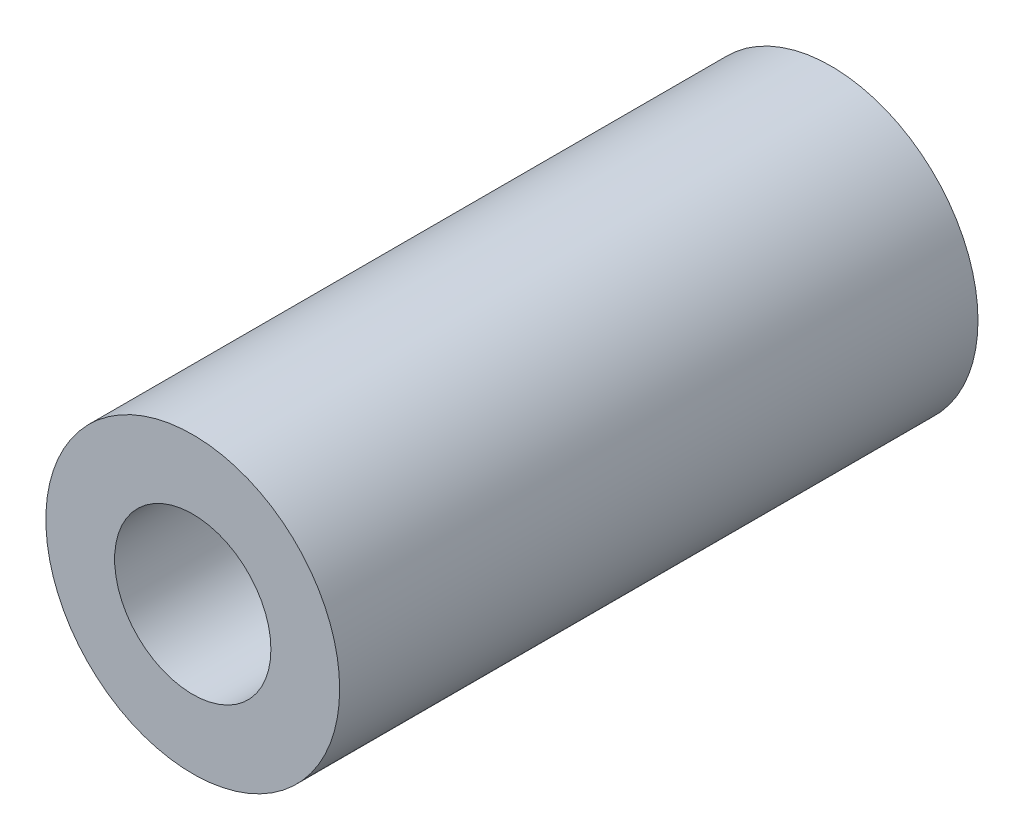
from build123d import *


with BuildPart() as part:
    # Sketch1 → Revolve1 (revolve)
    with BuildSketch(Plane(origin=(0, 0, 0), x_dir=(0, 0, -1), z_dir=(1, 0, 0)), mode=Mode.PRIVATE) as revolve1_sk:
        Polygon((0, 3.3782), (0, 6.35), (27.592250124, 6.35), (27.592250124, 4.6736), (28.100250124, 4.6736), (28.100250124, 3.3782), align=None)
    revolve(revolve1_sk.sketch.rotate(Axis((0, 0, 0), (0, 0, -1)), 90), axis=Axis((0, 0, 0), (0, 0, -1)))


solid = part.part
